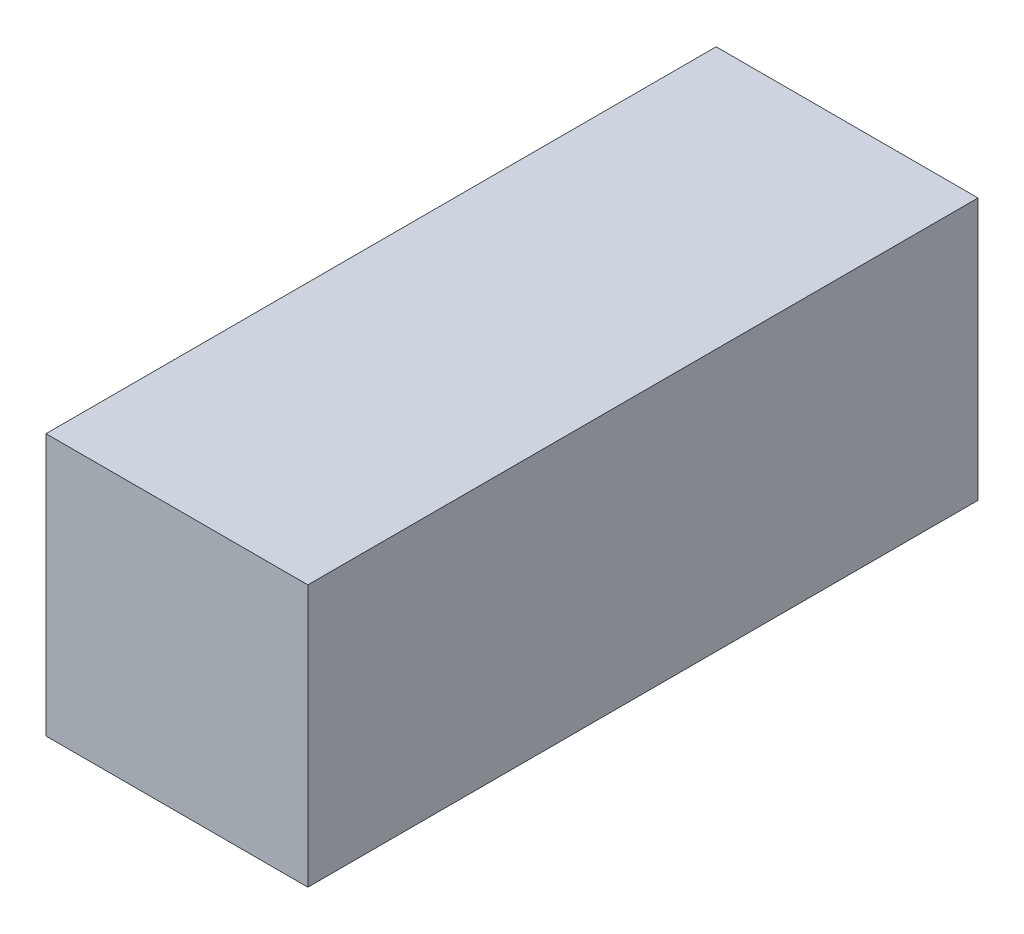
from build123d import *

# Parameters (mm, degrees)
SKETCH1_W           = 25.4
SKETCH1_H           = 25.4
BOSS_EXTRUDE1_DEPTH = 65


with BuildPart() as part:
    # Sketch1 → Boss-Extrude1 (new body)
    with BuildSketch(Plane.XY):
        Rectangle(SKETCH1_W, SKETCH1_H)
    extrude(amount=BOSS_EXTRUDE1_DEPTH)


solid = part.part
